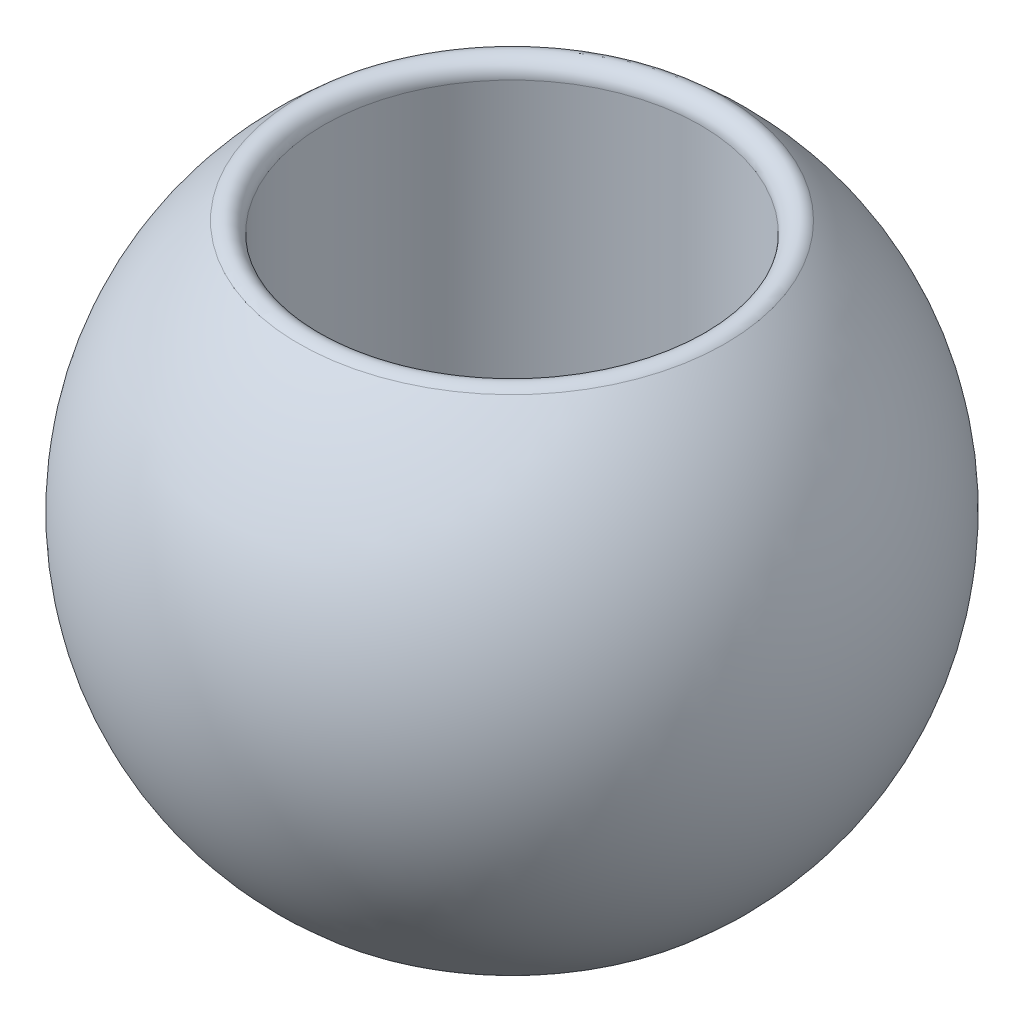
from build123d import *

# Parameters (mm, degrees)
SKETCH2_R          = 6.35
CUT_EXTRUDE1_DEPTH = 25.4
FILLET1_R          = 0.508


with BuildPart() as part:
    # Sketch1 → Revolve1 (revolve)
    with BuildSketch(Plane.XY):
        with BuildLine():
            Line((0, 11.1125), (0, -11.1125))
            ThreePointArc((0, -11.1125), (-11.1125, 0), (0, 11.1125))
        make_face()
    revolve(axis=Axis((0, 11.1125, 0), (0, -1, 0)))

    # Sketch2 → Cut-Extrude1 (cut, symmetric)
    with BuildSketch(Plane(origin=(0, 0, 0), x_dir=(1, 0, 0), z_dir=(0, 1, 0))):
        Circle(SKETCH2_R)
    extrude(amount=CUT_EXTRUDE1_DEPTH, both=True, mode=Mode.SUBTRACT)

    # Fillet1
    fillet1_edges = [part.edges().sort_by_distance(p)[0] for p in [
        (0, 9.119493201, -6.35),
        (0, -9.119493201, 6.35),
    ]]
    fillet(fillet1_edges, radius=FILLET1_R)


solid = part.part
